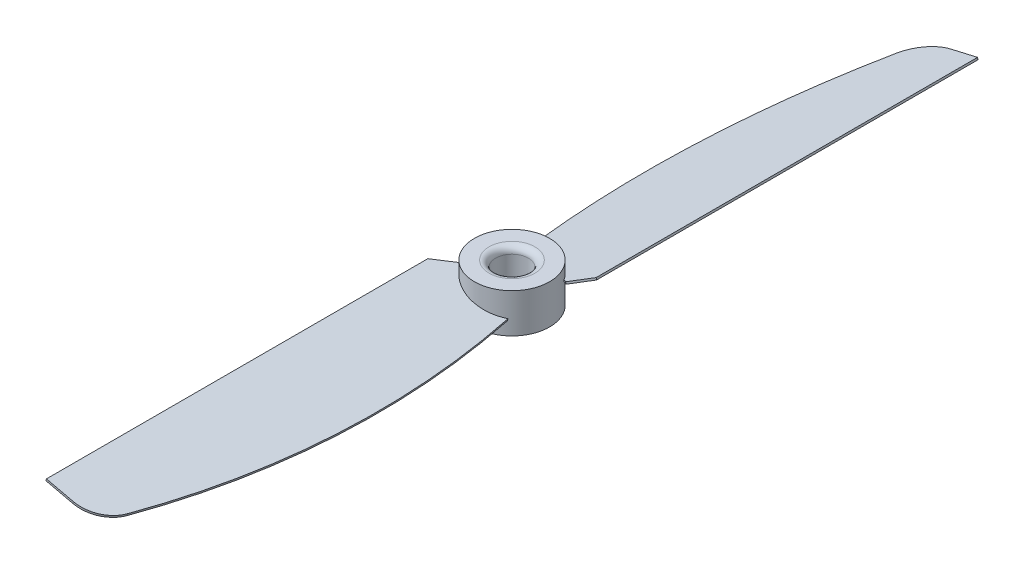
from build123d import *

# Parameters (mm, degrees)
SKETCH1_R           = 5.75
BOSS_EXTRUDE2_DEPTH = 3
BOSS_EXTRUDE3_DEPTH = 0.15
CIRPATTERN1_COUNT   = 2
SKETCH7_R           = 2.5
CUT_EXTRUDE1_DEPTH  = 65.252141201
FILLET1_R           = 1


with BuildPart() as part:
    # Sketch1 → Boss-Extrude2 (new, symmetric)
    with BuildSketch(Plane(origin=(0, 0, 0), x_dir=(1, 0, 0), z_dir=(0, 1, 0))):
        with Locations(Location((0, 0, 0), (0, 0, 270))):
            Circle(SKETCH1_R)
    extrude(amount=BOSS_EXTRUDE2_DEPTH, both=True)

    # Sketch6 → Boss-Extrude3 (add, symmetric)
    with BuildSketch(Plane(origin=(0, 0, 0), x_dir=(0.9743700647852352, -0.22495105434386534, 0), z_dir=(-0.2249510543438653, -0.9743700647852351, 0))):
        with BuildLine():
            Line((-5.557419516, 2.82), (-7.920891538, 5.18))
            Line((-7.920891538, 5.18), (-7.920891538, 63.5))
            Line((-7.920891538, 63.5), (-3.710891538, 63.5))
            ThreePointArc((-3.710891538, 63.5), (-0.694973133, 62.488011556), (1.100115443, 59.861694468))
            ThreePointArc((1.100115443, 59.861694468), (5.738056471, 28.958255312), (2.470780015, -2.12))
            ThreePointArc((2.470780015, -2.12), (-0.066255988, 2.750437774), (-5.557419516, 2.82))
        make_face()
    boss_extrude3 = extrude(amount=BOSS_EXTRUDE3_DEPTH, both=True)

    # CirPattern1: Boss-Extrude3 ×2 about axis
    cirpattern1_axis = Axis((0, 0, 0), (0, 1, 0))
    for i in range(1, CIRPATTERN1_COUNT):
        add(boss_extrude3.rotate(cirpattern1_axis, i * 360 / CIRPATTERN1_COUNT))

    # Sketch7 → Cut-Extrude1 (cut, through all)
    with BuildSketch(Plane(origin=(0, 3, 0), x_dir=(1, 0, 0), z_dir=(0, 1, 0))):
        with Locations(Location((0, 0, 0), (0, 0, 270))):
            Circle(SKETCH7_R)
    extrude(amount=-CUT_EXTRUDE1_DEPTH, mode=Mode.SUBTRACT)

    # Fillet1
    fillet1_edges = [part.edges().sort_by_distance(p)[0] for p in [
        (0, -3, -2.5),
        (0, 3, -2.5),
    ]]
    fillet(fillet1_edges, radius=FILLET1_R)


solid = part.part
